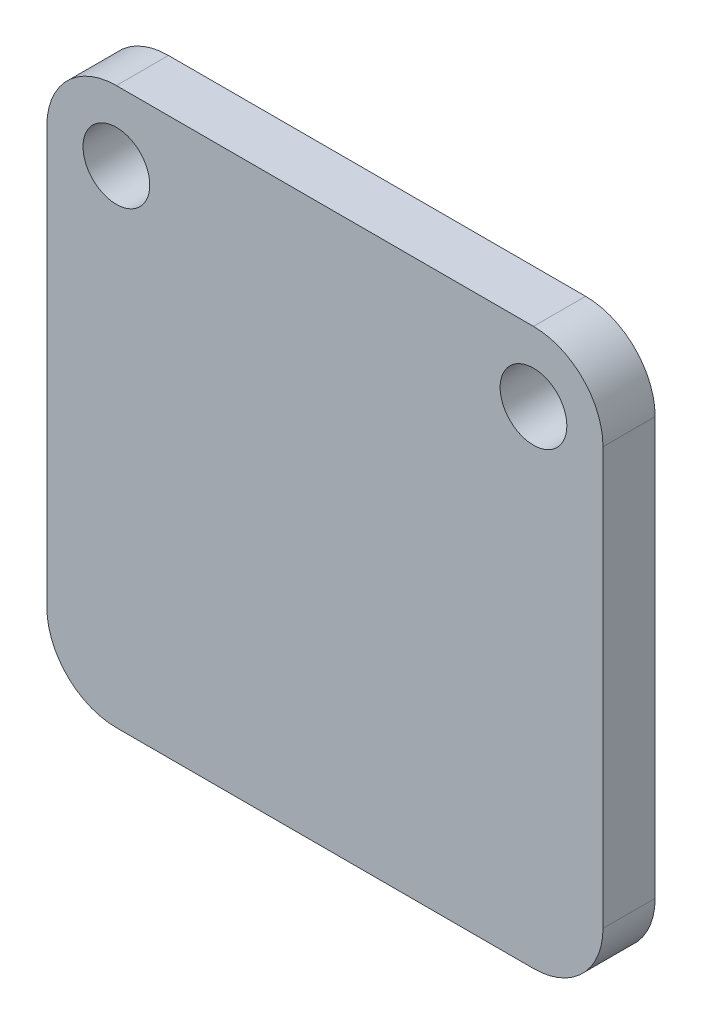
from build123d import *

# Parameters (mm, degrees)
SKETCH1_W           = 20.32
SKETCH1_H           = 20.32
BOSS_EXTRUDE1_DEPTH = 1.905
CUT_EXTRUDE1_REACH  = 16.494
SKETCH2_R           = 1.2192
FILLET1_R           = 2.54


with BuildPart() as part:
    # Sketch1 → Boss-Extrude1 (new body)
    with BuildSketch(Plane.XY):
        Rectangle(SKETCH1_W, SKETCH1_H)
    extrude(amount=BOSS_EXTRUDE1_DEPTH)

    # Sketch2 → Cut-Extrude1 (cut, up to next)
    with BuildSketch(Plane.XY.offset(1.905), mode=Mode.PRIVATE) as cut_extrude1_sk1:
        with Locations((-7.62, 7.62)):
            Circle(SKETCH2_R)
    cut_extrude1_tool1 = extrude(cut_extrude1_sk1.sketch, amount=-CUT_EXTRUDE1_REACH, mode=Mode.PRIVATE) & part.part
    # Sketch2 → Cut-Extrude1 (cut, up to next)
    with BuildSketch(Plane.XY.offset(1.905), mode=Mode.PRIVATE) as cut_extrude1_sk2:
        with Locations((7.62, 7.62)):
            Circle(SKETCH2_R)
    cut_extrude1_tool2 = extrude(cut_extrude1_sk2.sketch, amount=-CUT_EXTRUDE1_REACH, mode=Mode.PRIVATE) & part.part
    add(cut_extrude1_tool1.solids().sort_by_distance((-7.62, 7.62, 1.905))[0], mode=Mode.SUBTRACT)
    add(cut_extrude1_tool2.solids().sort_by_distance((7.62, 7.62, 1.905))[0], mode=Mode.SUBTRACT)

    # Fillet1
    fillet1_edges = [part.edges().sort_by_distance(p)[0] for p in [
        (-10.16, 10.16, 0.9525),
        (10.16, 10.16, 0.9525),
        (10.16, -10.16, 0.9525),
        (-10.16, -10.16, 0.9525),
    ]]
    fillet(fillet1_edges, radius=FILLET1_R)


solid = part.part
